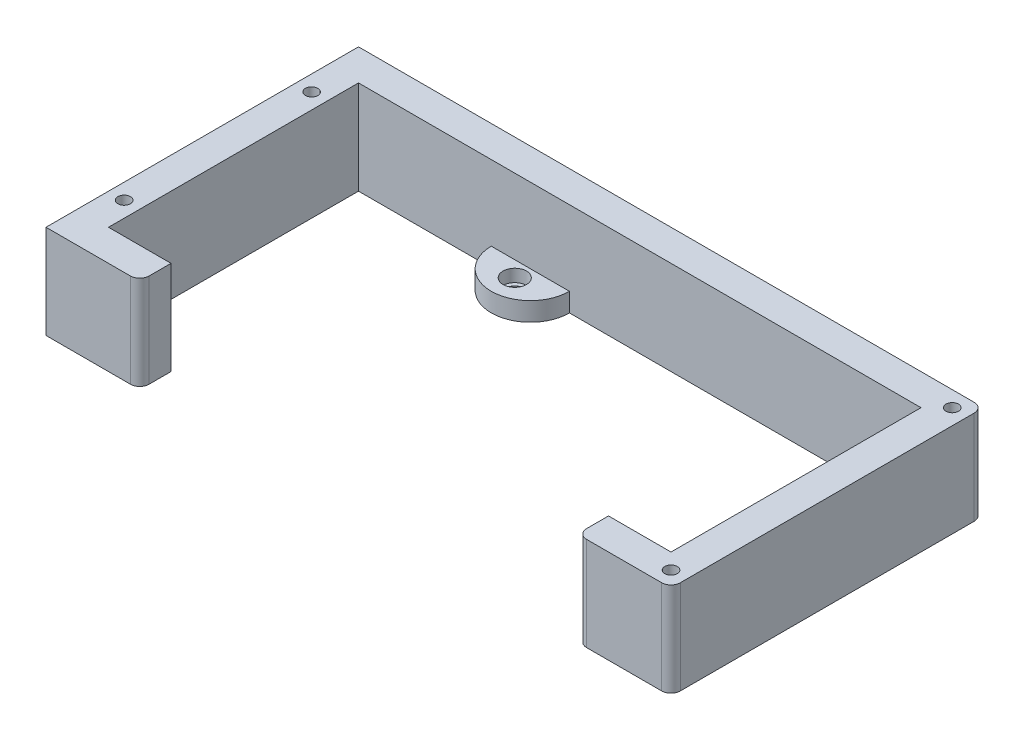
from build123d import *

# Parameters (mm, degrees)
SKETCH1_W           = 200
SKETCH1_H           = 100
SKETCH1_W_2         = 180
SKETCH1_H_2         = 80
BOSS_EXTRUDE1_DEPTH = 30
SKETCH2_R           = 2.5
BOSS_EXTRUDE2_DEPTH = 6
SKETCH3_R           = 3.75
CUT_EXTRUDE1_DEPTH  = 4
SKETCH4_R           = 2
CUT_EXTRUDE2_DEPTH  = 15
SKETCH5_W           = 140
SKETCH5_H           = 10
CUT_EXTRUDE3_DEPTH  = 116.758369028
FILLET1_R           = 3


with BuildPart() as part:
    # Sketch1 → Boss-Extrude1 (new body)
    with BuildSketch(Plane(origin=(0, 0, 0), x_dir=(1, 0, 0), z_dir=(0, 1, 0))):
        Rectangle(SKETCH1_W, SKETCH1_H)
        Rectangle(SKETCH1_W_2, SKETCH1_H_2, mode=Mode.SUBTRACT)
    extrude(amount=BOSS_EXTRUDE1_DEPTH)

    # Sketch2 → Boss-Extrude2 (add)
    # profile 1 of 3: a face of its own
    with BuildSketch(Plane(origin=(0, 0, 0), x_dir=(1, 0, 0), z_dir=(0, 1, 0))):
        with BuildLine():
            Line((77.5, 40), (90, 40))
            Line((90, 40), (90, 27.5))
            ThreePointArc((90, 27.5), (81.161165235, 31.161165235), (77.5, 40))
        make_face()
        with Locations(Location((85, 35, 0), (0, 0, 270))):
            Circle(SKETCH2_R, mode=Mode.SUBTRACT)
    # profile 2 of 3: a face of its own
    with BuildSketch(Plane(origin=(0, 0, 0), x_dir=(1, 0, 0), z_dir=(0, 1, 0))):
        with BuildLine():
            Line((90, -40), (90, -27.5))
            ThreePointArc((90, -27.5), (81.161165235, -31.161165235), (77.5, -40))
            Line((77.5, -40), (90, -40))
        make_face()
        with Locations(Location((85, -35, 0), (0, 0, 90))):
            Circle(SKETCH2_R, mode=Mode.SUBTRACT)
    # profile 3 of 3: a face of its own
    with BuildSketch(Plane(origin=(0, 0, 0), x_dir=(1, 0, 0), z_dir=(0, 1, 0))):
        with BuildLine():
            Line((-47.5, 40), (-22.5, 40))
            ThreePointArc((-22.5, 40), (-35, 27.5), (-47.5, 40))
        make_face()
        with Locations(Location((-35, 35, 0), (0, 0, 270))):
            Circle(SKETCH2_R, mode=Mode.SUBTRACT)
    extrude(amount=BOSS_EXTRUDE2_DEPTH)

    # Sketch3 → Cut-Extrude1 (cut)
    with BuildSketch(Plane(origin=(0, 6, 0), x_dir=(1, 0, 0), z_dir=(0, 1, 0))):
        with Locations(Location((-35, 35, 0), (0, 0, 270))):
            Circle(SKETCH3_R)
        with Locations(Location((85, 35, 0), (0, 0, 270))):
            Circle(SKETCH3_R)
        with Locations(Location((85, -35, 0), (0, 0, 90))):
            Circle(SKETCH3_R)
    extrude(amount=-CUT_EXTRUDE1_DEPTH, mode=Mode.SUBTRACT)

    # Sketch4 → Cut-Extrude2 (cut)
    with BuildSketch(Plane(origin=(0, 30, 0), x_dir=(1, 0, 0), z_dir=(0, 1, 0))):
        with Locations(Location((95, 45, 0), (0, 0, 270))):
            Circle(SKETCH4_R)
        with Locations(Location((95, -45, 0), (0, 0, 90))):
            Circle(SKETCH4_R)
        with Locations(Location((-95, 30, 0), (0, 0, 270))):
            Circle(SKETCH4_R)
        with Locations(Location((-95, -30, 0), (0, 0, 90))):
            Circle(SKETCH4_R)
    extrude(amount=-CUT_EXTRUDE2_DEPTH, mode=Mode.SUBTRACT)

    # Sketch5 → Cut-Extrude3 (cut, through all)
    with BuildSketch(Plane(origin=(0, 30, 0), x_dir=(1, 0, 0), z_dir=(0, 1, 0))):
        with Locations((0, -45)):
            Rectangle(SKETCH5_W, SKETCH5_H)
    extrude(amount=-CUT_EXTRUDE3_DEPTH, mode=Mode.SUBTRACT)

    # Fillet1
    fillet1_edges = [part.edges().sort_by_distance(p)[0] for p in [
        (70, 15, 50),
        (-70, 15, 50),
        (100, 15, 50),
        (100, 15, -50),
    ]]
    fillet(fillet1_edges, radius=FILLET1_R)


solid = part.part
